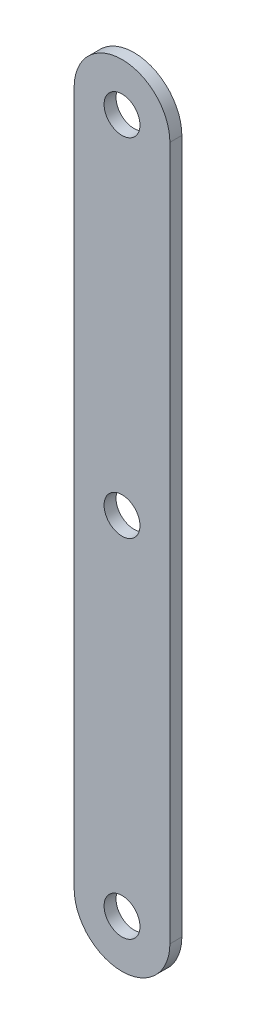
from build123d import *

# Parameters (mm, degrees)
SKETCH1_R           = 7.5
BOSS_EXTRUDE1_DEPTH = 5


with BuildPart() as part:
    # Sketch1 → Boss-Extrude1 (new body)
    with BuildSketch(Plane.XY):
        with BuildLine():
            Line((-20, -145), (-20, 145))
            ThreePointArc((-20, 145), (0, 165), (20, 145))
            Line((20, 145), (20, -145))
            ThreePointArc((20, -145), (0, -165), (-20, -145))
        make_face()
        with Locations((0, 145)):
            Circle(SKETCH1_R, mode=Mode.SUBTRACT)
        Circle(SKETCH1_R, mode=Mode.SUBTRACT)
        with Locations((0, -145)):
            Circle(SKETCH1_R, mode=Mode.SUBTRACT)
    extrude(amount=BOSS_EXTRUDE1_DEPTH)


solid = part.part
